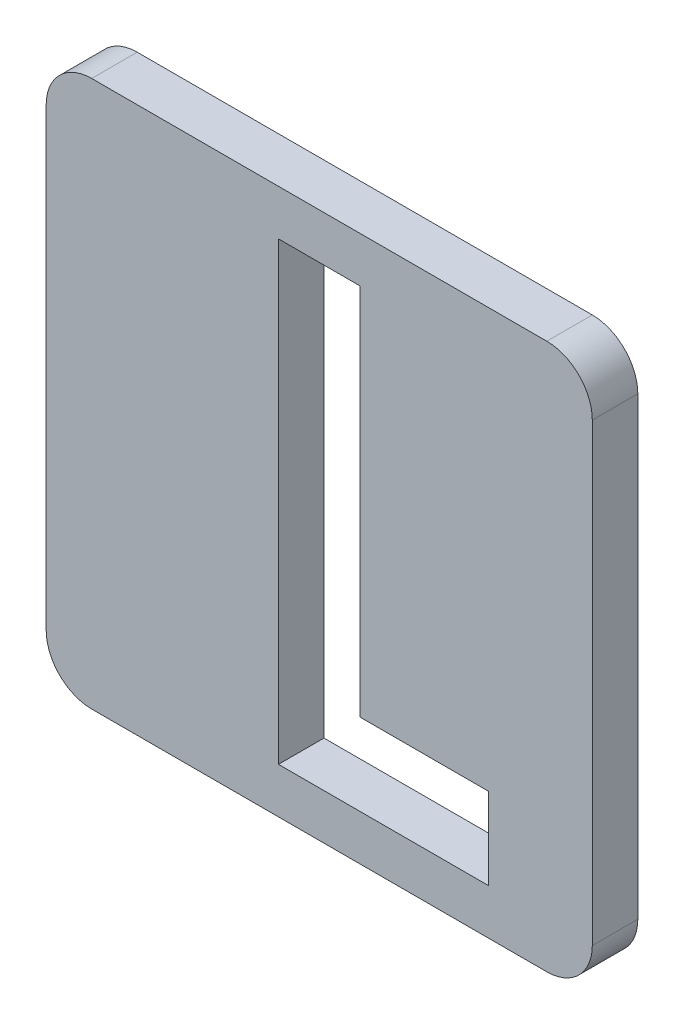
from build123d import *

# Parameters (mm, degrees)
BOSS_EXTRUDE1_DEPTH = 10
CUT_EXTRUDE25_DEPTH = 10


with BuildPart() as part:
    # Sketch1 → Boss-Extrude1 (new body)
    with BuildSketch(Plane.XY):
        with BuildLine():
            Line((-50, 60), (50, 60))
            ThreePointArc((50, 60), (57.071067812, 57.071067812), (60, 50))
            Line((60, 50), (60, -50))
            ThreePointArc((60, -50), (57.071067812, -57.071067812), (50, -60))
            Line((50, -60), (-50, -60))
            ThreePointArc((-50, -60), (-57.071067812, -57.071067812), (-60, -50))
            Line((-60, -50), (-60, 50))
            ThreePointArc((-60, 50), (-57.071067812, 57.071067812), (-50, 60))
        make_face()
    extrude(amount=BOSS_EXTRUDE1_DEPTH)

    # Sketch2 → Cut-Extrude25 (cut)
    with BuildSketch(Plane.XY.offset(10)):
        Polygon((-8.961538462, 50), (8.987179487, 50), (8.987179487, -32.051282051), (37.192307692, -32.051282051), (37.192307692, -50), (-8.961538462, -50), align=None)
    extrude(amount=-CUT_EXTRUDE25_DEPTH, mode=Mode.SUBTRACT)


solid = part.part
